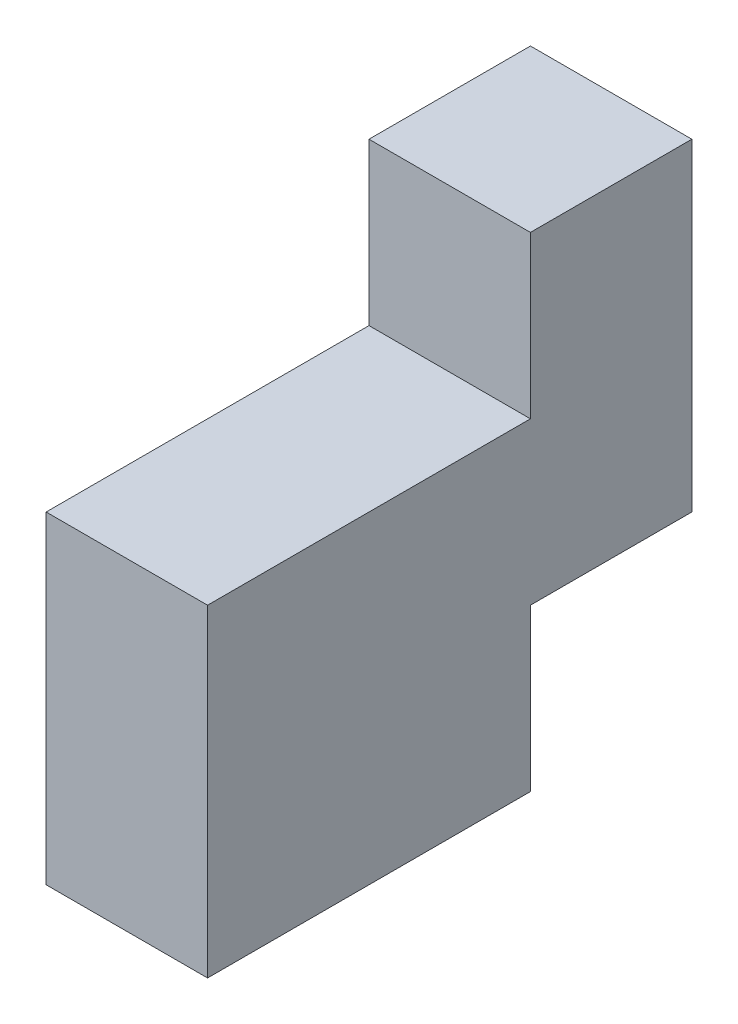
from build123d import *

# Parameters (mm, degrees)
SKETCH1_W           = 25.4
SKETCH1_H           = 76.2
BOSS_EXTRUDE3_DEPTH = 25.4
SKETCH3_W           = 25.4
SKETCH3_H           = 25.4
BOSS_EXTRUDE4_DEPTH = 25.4
SKETCH5_W           = 25.4
SKETCH5_H           = 25.4
BOSS_EXTRUDE5_DEPTH = 25.4
SKETCH7_W           = 25.4
SKETCH7_H           = 25.4
BOSS_EXTRUDE6_DEPTH = 25.4


with BuildPart() as part:
    # Sketch1 → Boss-Extrude3 (new body)
    with BuildSketch(Plane(origin=(0, 0, 0), x_dir=(1, 0, 0), z_dir=(0, 1, 0))):
        with Locations((12.7, -38.1)):
            Rectangle(SKETCH1_W, SKETCH1_H)
    extrude(amount=BOSS_EXTRUDE3_DEPTH)

    # Sketch3 → Boss-Extrude4 (add)
    with BuildSketch(Plane(origin=(0, 25.4, 0), x_dir=(1, 0, 0), z_dir=(0, 1, 0))):
        with Locations((12.7, -12.7)):
            Rectangle(SKETCH3_W, SKETCH3_H)
    extrude(amount=BOSS_EXTRUDE4_DEPTH)

    # Sketch5 → Boss-Extrude5 (add)
    with BuildSketch(Plane(origin=(0, 0, 0), x_dir=(-1, 0, 0), z_dir=(0, -1, 0))):
        with Locations((-12.7, -63.5)):
            Rectangle(SKETCH5_W, SKETCH5_H)
    extrude(amount=BOSS_EXTRUDE5_DEPTH)

    # Sketch7 → Boss-Extrude6 (add)
    with BuildSketch(Plane(origin=(0, 0, 50.8), x_dir=(-1, 0, 0), z_dir=(0, 0, -1))):
        with Locations((-12.7, -12.7)):
            Rectangle(SKETCH7_W, SKETCH7_H)
    extrude(amount=BOSS_EXTRUDE6_DEPTH)


solid = part.part
